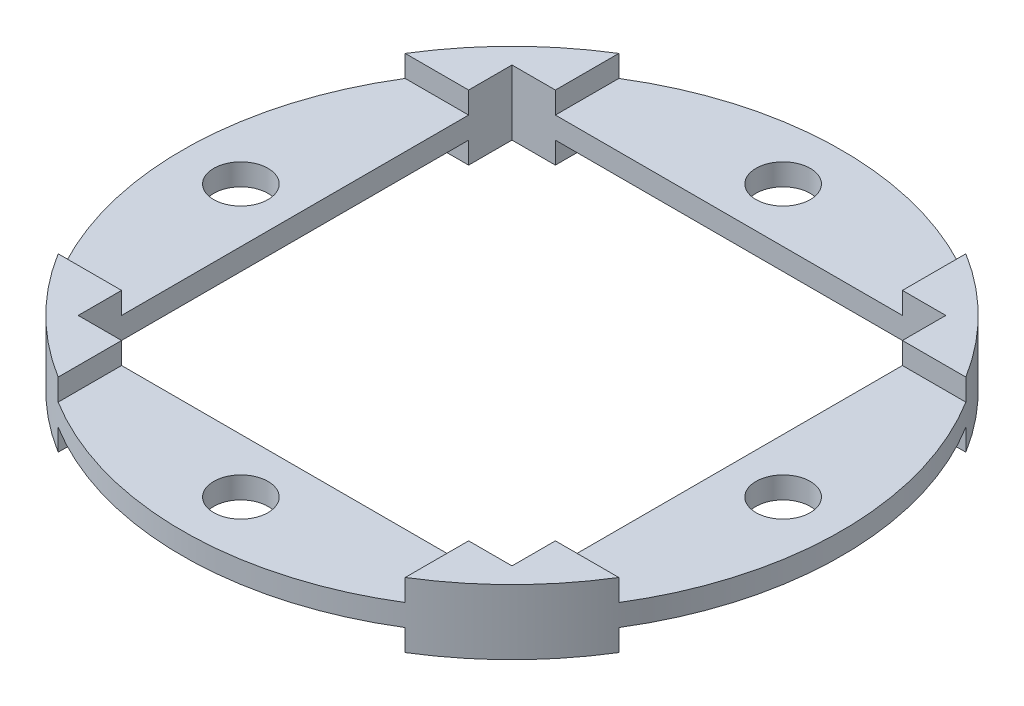
from build123d import *
from build123d.topology import SkipClean

# Parameters (mm, degrees)
SKETCH1_R           = 76
SKETCH1_W           = 100
SKETCH1_H           = 100
BOSS_EXTRUDE1_DEPTH = 5
SKETCH2_R           = 6.25
CUT_EXTRUDE1_DEPTH  = 10
BOSS_EXTRUDE2_DEPTH = 5
BOSS_EXTRUDE4_START = -15
BOSS_EXTRUDE4_DEPTH = 15


with BuildPart() as part:
    # Sketch1 → Boss-Extrude1 (new body)
    with BuildSketch(Plane(origin=(0, 0, 0), x_dir=(1, 0, 0), z_dir=(0, 1, 0))):
        with Locations(Location((0, 0, 0), (0, 0, 270))):
            Circle(SKETCH1_R)
        Rectangle(SKETCH1_W, SKETCH1_H, mode=Mode.SUBTRACT)
    extrude(amount=BOSS_EXTRUDE1_DEPTH)

    # Sketch2 → Cut-Extrude1 (cut)
    with BuildSketch(Plane(origin=(0, 5, 0), x_dir=(1, 0, 0), z_dir=(0, 1, 0))):
        with Locations(Location((-62.5, 0, 0), (0, 0, 270))):
            Circle(SKETCH2_R)
        with Locations(Location((0, 62.5, 0), (0, 0, 270))):
            Circle(SKETCH2_R)
        with Locations(Location((62.5, 0, 0), (0, 0, 270))):
            Circle(SKETCH2_R)
        with Locations(Location((0, -62.5, 0), (0, 0, 270))):
            Circle(SKETCH2_R)
    extrude(amount=-CUT_EXTRUDE1_DEPTH, mode=Mode.SUBTRACT)

    # Sketch3 → Boss-Extrude2 (add)
    with BuildSketch(Plane(origin=(0, 5, 0), x_dir=(1, 0, 0), z_dir=(0, 1, 0))):
        with BuildLine():
            Line((50, -50), (40, -50))
            Line((40, -50), (40, -64.621977686))
            ThreePointArc((40, -64.621977686), (53.74011537, -53.74011537), (64.621977686, -40))
            Line((64.621977686, -40), (50, -40))
            Line((50, -40), (50, -50))
        make_face()
        with BuildLine():
            Line((-40, -50), (-50, -50))
            Line((-50, -50), (-50, -40))
            Line((-50, -40), (-64.621977686, -40))
            ThreePointArc((-64.621977686, -40), (-53.74011537, -53.74011537), (-40, -64.621977686))
            Line((-40, -64.621977686), (-40, -50))
        make_face()
        with BuildLine():
            Line((-64.621977686, 40), (-50, 40))
            Line((-50, 40), (-50, 50))
            Line((-50, 50), (-40, 50))
            Line((-40, 50), (-40, 64.621977686))
            ThreePointArc((-40, 64.621977686), (-53.74011537, 53.74011537), (-64.621977686, 40))
        make_face()
        with BuildLine():
            Line((50, 50), (50, 40))
            Line((50, 40), (64.621977686, 40))
            ThreePointArc((64.621977686, 40), (53.74011537, 53.74011537), (40, 64.621977686))
            Line((40, 64.621977686), (40, 50))
            Line((40, 50), (50, 50))
        make_face()
    extrude(amount=BOSS_EXTRUDE2_DEPTH)

    # Sketch4 → Boss-Extrude4 (add)
    with SkipClean():  # the faces are left unmerged after this step: merging them gives an invalid solid
        with BuildSketch(Plane(origin=(0, 10, 0), x_dir=(1, 0, 0), z_dir=(0, 1, 0)).offset(BOSS_EXTRUDE4_START)):
            with BuildLine():
                Line((50, 50), (50, 40))
                Line((50, 40), (64.621977686, 40))
                ThreePointArc((64.621977686, 40), (53.74011537, 53.74011537), (40, 64.621977686))
                Line((40, 64.621977686), (40, 50))
                Line((40, 50), (50, 50))
            make_face()
            with BuildLine():
                Line((-50, 50), (-40, 50))
                Line((-40, 50), (-40, 64.621977686))
                ThreePointArc((-40, 64.621977686), (-53.74011537, 53.74011537), (-64.621977686, 40))
                Line((-64.621977686, 40), (-50, 40))
                Line((-50, 40), (-50, 50))
            make_face()
            with BuildLine():
                Line((-40, -64.621977686), (-40, -50))
                Line((-40, -50), (-50, -50))
                Line((-50, -50), (-50, -40))
                Line((-50, -40), (-64.621977686, -40))
                ThreePointArc((-64.621977686, -40), (-53.74011537, -53.74011537), (-40, -64.621977686))
            make_face()
            with BuildLine():
                Line((50, -50), (40, -50))
                Line((40, -50), (40, -64.621977686))
                ThreePointArc((40, -64.621977686), (53.74011537, -53.74011537), (64.621977686, -40))
                Line((64.621977686, -40), (50, -40))
                Line((50, -40), (50, -50))
            make_face()
        extrude(amount=BOSS_EXTRUDE4_DEPTH)


solid = part.part
